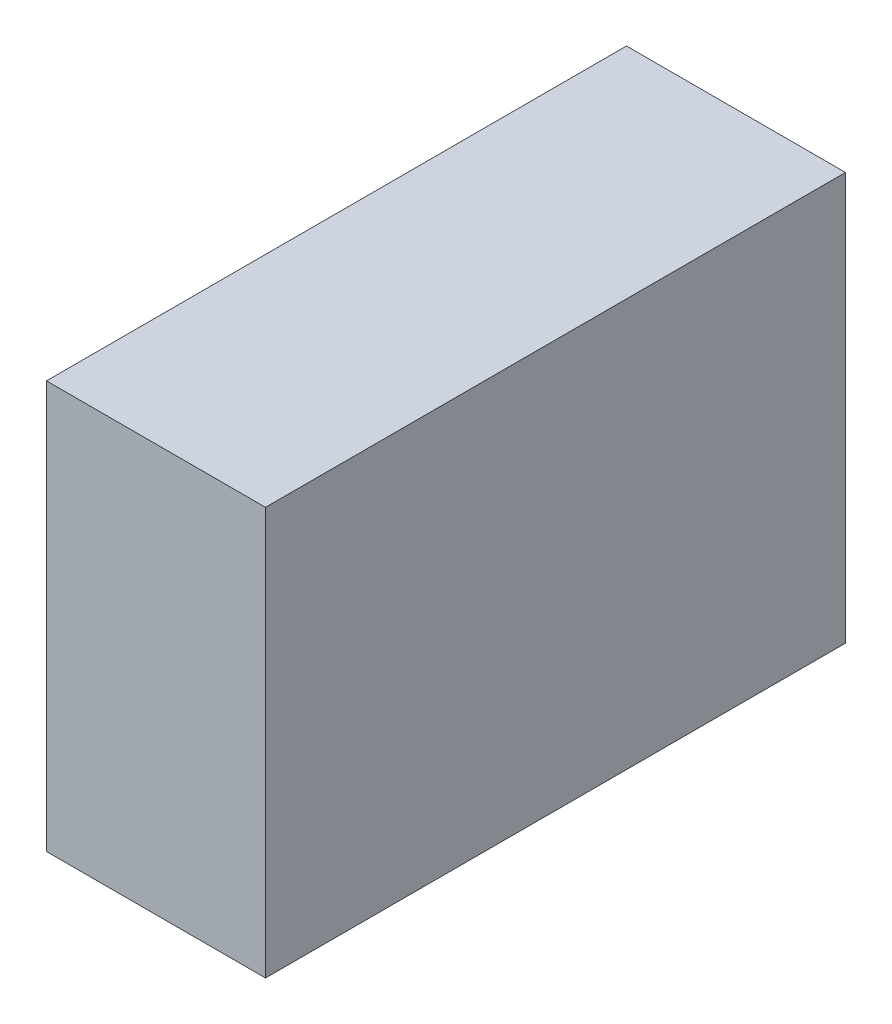
from build123d import *

# Parameters (mm, degrees)
SKETCH1_W           = 171.45
SKETCH1_H           = 454.025
BOSS_EXTRUDE1_DEPTH = 319.0875


with BuildPart() as part:
    # Sketch1 → Boss-Extrude1 (new body)
    with BuildSketch(Plane(origin=(0, 0, 0), x_dir=(1, 0, 0), z_dir=(0, 1, 0))):
        with Locations((85.725, 227.0125)):
            Rectangle(SKETCH1_W, SKETCH1_H)
    extrude(amount=BOSS_EXTRUDE1_DEPTH)


solid = part.part
